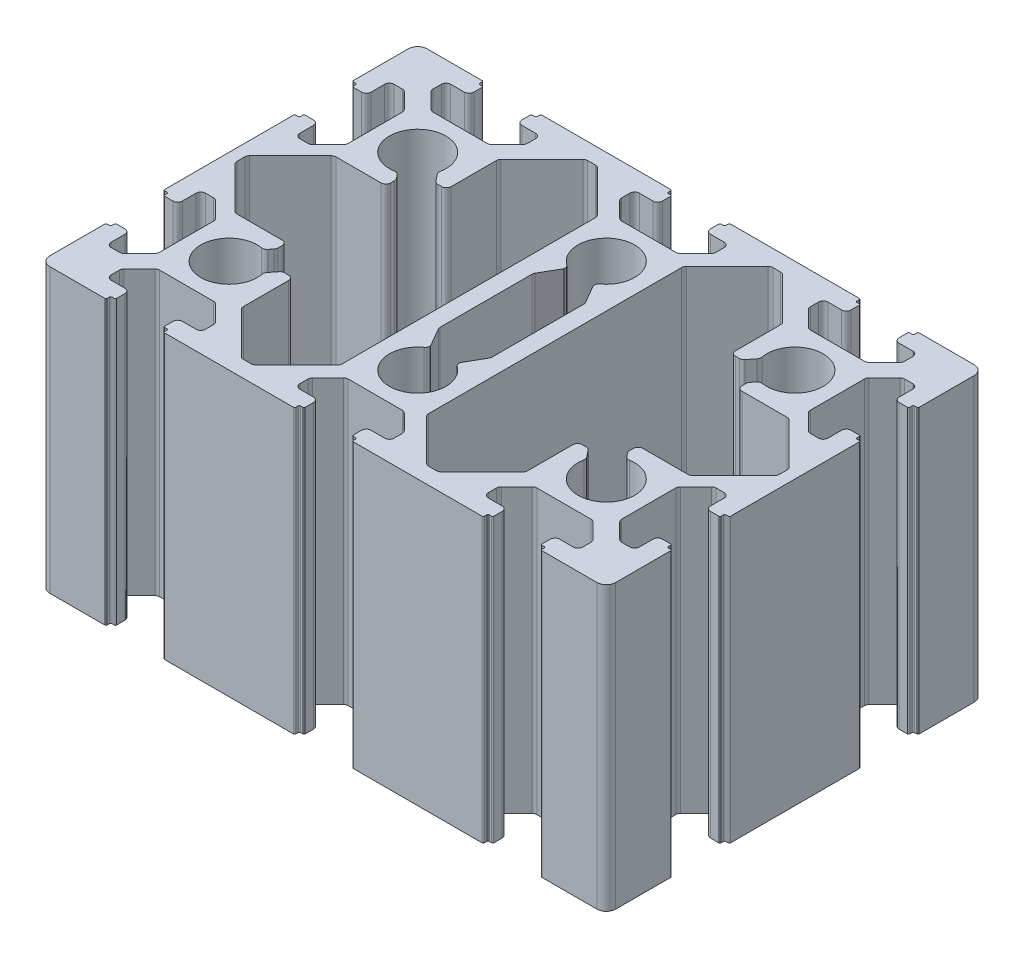
from build123d import *

# Parameters (mm, degrees)
BOSS_EXTRUDE1_DEPTH = 60


with BuildPart() as part:
    # Sketch5 → Boss-Extrude1 (new body)
    with BuildSketch(Plane(origin=(0, 0, 0), x_dir=(1, 0, 0), z_dir=(0, 1, 0))):
        with BuildLine():
            Line((5.735786438, 29), (-5.735786438, 29))
            ThreePointArc((-5.735786438, 29), (-6.11846987, 29.076120467), (-6.442893219, 29.292893219))
            Line((-6.442893219, 29.292893219), (-9.707106781, 32.557106781))
            ThreePointArc((-9.707106781, 32.557106781), (-9.923879533, 32.88153013), (-10, 33.264213562))
            Line((-10, 33.264213562), (-10, 35))
            ThreePointArc((-10, 35), (-9.707106781, 35.707106781), (-9, 36))
            Line((-9, 36), (-6.1, 36))
            ThreePointArc((-6.1, 36), (-5.392893219, 36.292893219), (-5.1, 37))
            Line((-5.1, 37), (-5.1, 38.75))
            ThreePointArc((-5.1, 38.75), (-5.173223305, 38.926776695), (-5.35, 39))
            Line((-5.35, 39), (-5.85, 39))
            ThreePointArc((-5.85, 39), (-6.026776695, 39.073223305), (-6.1, 39.25))
            Line((-6.1, 39.25), (-6.1, 39.75))
            ThreePointArc((-6.1, 39.75), (-6.173223305, 39.926776695), (-6.35, 40))
            Line((-6.35, 40), (-33.65, 40))
            ThreePointArc((-33.65, 40), (-33.826776695, 39.926776695), (-33.9, 39.75))
            Line((-33.9, 39.75), (-33.9, 39.25))
            ThreePointArc((-33.9, 39.25), (-33.973223305, 39.073223305), (-34.15, 39))
            Line((-34.15, 39), (-34.65, 39))
            ThreePointArc((-34.65, 39), (-34.826776695, 38.926776695), (-34.9, 38.75))
            Line((-34.9, 38.75), (-34.9, 37))
            ThreePointArc((-34.9, 37), (-34.607106781, 36.292893219), (-33.9, 36))
            Line((-33.9, 36), (-31, 36))
            ThreePointArc((-31, 36), (-30.292893219, 35.707106781), (-30, 35))
            Line((-30, 35), (-30, 33.264213562))
            ThreePointArc((-30, 33.264213562), (-30.076120467, 32.88153013), (-30.292893219, 32.557106781))
            Line((-30.292893219, 32.557106781), (-33.557106781, 29.292893219))
            ThreePointArc((-33.557106781, 29.292893219), (-33.88153013, 29.076120467), (-34.264213562, 29))
            Line((-34.264213562, 29), (-45.735786438, 29))
            ThreePointArc((-45.735786438, 29), (-46.11846987, 29.076120467), (-46.442893219, 29.292893219))
            Line((-46.442893219, 29.292893219), (-49.707106781, 32.557106781))
            ThreePointArc((-49.707106781, 32.557106781), (-49.923879533, 32.88153013), (-50, 33.264213562))
            Line((-50, 33.264213562), (-50, 35))
            ThreePointArc((-50, 35), (-49.707106781, 35.707106781), (-49, 36))
            Line((-49, 36), (-46.1, 36))
            ThreePointArc((-46.1, 36), (-45.392893219, 36.292893219), (-45.1, 37))
            Line((-45.1, 37), (-45.1, 38.75))
            ThreePointArc((-45.1, 38.75), (-45.173223305, 38.926776695), (-45.35, 39))
            Line((-45.35, 39), (-45.85, 39))
            ThreePointArc((-45.85, 39), (-46.026776695, 39.073223305), (-46.1, 39.25))
            Line((-46.1, 39.25), (-46.1, 39.75))
            ThreePointArc((-46.1, 39.75), (-46.173223305, 39.926776695), (-46.35, 40))
            Line((-46.35, 40), (-58, 40))
            ThreePointArc((-58, 40), (-59.414213562, 39.414213562), (-60, 38))
            Line((-60, 38), (-60, 26.35))
            ThreePointArc((-60, 26.35), (-59.926776695, 26.173223305), (-59.75, 26.1))
            Line((-59.75, 26.1), (-59.25, 26.1))
            ThreePointArc((-59.25, 26.1), (-59.073223305, 26.026776695), (-59, 25.85))
            Line((-59, 25.85), (-59, 25.35))
            ThreePointArc((-59, 25.35), (-58.926776695, 25.173223305), (-58.75, 25.1))
            Line((-58.75, 25.1), (-57, 25.1))
            ThreePointArc((-57, 25.1), (-56.292893219, 25.392893219), (-56, 26.1))
            Line((-56, 26.1), (-56, 29))
            ThreePointArc((-56, 29), (-55.707106781, 29.707106781), (-55, 30))
            Line((-55, 30), (-53.264213562, 30))
            ThreePointArc((-53.264213562, 30), (-52.88153013, 29.923879533), (-52.557106781, 29.707106781))
            Line((-52.557106781, 29.707106781), (-49.292893219, 26.442893219))
            ThreePointArc((-49.292893219, 26.442893219), (-49.076120467, 26.11846987), (-49, 25.735786438))
            Line((-49, 25.735786438), (-49, 14.264213562))
            ThreePointArc((-49, 14.264213562), (-49.076120467, 13.88153013), (-49.292893219, 13.557106781))
            Line((-49.292893219, 13.557106781), (-52.557106781, 10.292893219))
            ThreePointArc((-52.557106781, 10.292893219), (-52.88153013, 10.076120467), (-53.264213562, 10))
            Line((-53.264213562, 10), (-55, 10))
            ThreePointArc((-55, 10), (-55.707106781, 10.292893219), (-56, 11))
            Line((-56, 11), (-56, 13.9))
            ThreePointArc((-56, 13.9), (-56.292893219, 14.607106781), (-57, 14.9))
            Line((-57, 14.9), (-58.75, 14.9))
            ThreePointArc((-58.75, 14.9), (-58.926776695, 14.826776695), (-59, 14.65))
            Line((-59, 14.65), (-59, 14.15))
            ThreePointArc((-59, 14.15), (-59.073223305, 13.973223305), (-59.25, 13.9))
            Line((-59.25, 13.9), (-59.75, 13.9))
            ThreePointArc((-59.75, 13.9), (-59.926776695, 13.826776695), (-60, 13.65))
            Line((-60, 13.65), (-60, -13.65))
            ThreePointArc((-60, -13.65), (-59.926776695, -13.826776695), (-59.75, -13.9))
            Line((-59.75, -13.9), (-59.25, -13.9))
            ThreePointArc((-59.25, -13.9), (-59.073223305, -13.973223305), (-59, -14.15))
            Line((-59, -14.15), (-59, -14.65))
            ThreePointArc((-59, -14.65), (-58.926776695, -14.826776695), (-58.75, -14.9))
            Line((-58.75, -14.9), (-57, -14.9))
            ThreePointArc((-57, -14.9), (-56.292893219, -14.607106781), (-56, -13.9))
            Line((-56, -13.9), (-56, -11))
            ThreePointArc((-56, -11), (-55.707106781, -10.292893219), (-55, -10))
            Line((-55, -10), (-53.264213562, -10))
            ThreePointArc((-53.264213562, -10), (-52.88153013, -10.076120467), (-52.557106781, -10.292893219))
            Line((-52.557106781, -10.292893219), (-49.292893219, -13.557106781))
            ThreePointArc((-49.292893219, -13.557106781), (-49.076120467, -13.88153013), (-49, -14.264213562))
            Line((-49, -14.264213562), (-49, -25.735786438))
            ThreePointArc((-49, -25.735786438), (-49.076120467, -26.11846987), (-49.292893219, -26.442893219))
            Line((-49.292893219, -26.442893219), (-52.557106781, -29.707106781))
            ThreePointArc((-52.557106781, -29.707106781), (-52.88153013, -29.923879533), (-53.264213562, -30))
            Line((-53.264213562, -30), (-55, -30))
            ThreePointArc((-55, -30), (-55.707106781, -29.707106781), (-56, -29))
            Line((-56, -29), (-56, -26.1))
            ThreePointArc((-56, -26.1), (-56.292893219, -25.392893219), (-57, -25.1))
            Line((-57, -25.1), (-58.75, -25.1))
            ThreePointArc((-58.75, -25.1), (-58.926776695, -25.173223305), (-59, -25.35))
            Line((-59, -25.35), (-59, -25.85))
            ThreePointArc((-59, -25.85), (-59.073223305, -26.026776695), (-59.25, -26.1))
            Line((-59.25, -26.1), (-59.75, -26.1))
            ThreePointArc((-59.75, -26.1), (-59.926776695, -26.173223305), (-60, -26.35))
            Line((-60, -26.35), (-60, -38))
            ThreePointArc((-60, -38), (-59.414213562, -39.414213562), (-58, -40))
            Line((-58, -40), (-46.35, -40))
            ThreePointArc((-46.35, -40), (-46.173223305, -39.926776695), (-46.1, -39.75))
            Line((-46.1, -39.75), (-46.1, -39.25))
            ThreePointArc((-46.1, -39.25), (-46.026776695, -39.073223305), (-45.85, -39))
            Line((-45.85, -39), (-45.35, -39))
            ThreePointArc((-45.35, -39), (-45.173223305, -38.926776695), (-45.1, -38.75))
            Line((-45.1, -38.75), (-45.1, -37))
            ThreePointArc((-45.1, -37), (-45.392893219, -36.292893219), (-46.1, -36))
            Line((-46.1, -36), (-49, -36))
            ThreePointArc((-49, -36), (-49.707106781, -35.707106781), (-50, -35))
            Line((-50, -35), (-50, -33.264213562))
            ThreePointArc((-50, -33.264213562), (-49.923879533, -32.88153013), (-49.707106781, -32.557106781))
            Line((-49.707106781, -32.557106781), (-46.442893219, -29.292893219))
            ThreePointArc((-46.442893219, -29.292893219), (-46.11846987, -29.076120467), (-45.735786438, -29))
            Line((-45.735786438, -29), (-34.264213562, -29))
            ThreePointArc((-34.264213562, -29), (-33.88153013, -29.076120467), (-33.557106781, -29.292893219))
            Line((-33.557106781, -29.292893219), (-30.292893219, -32.557106781))
            ThreePointArc((-30.292893219, -32.557106781), (-30.076120467, -32.88153013), (-30, -33.264213562))
            Line((-30, -33.264213562), (-30, -35))
            ThreePointArc((-30, -35), (-30.292893219, -35.707106781), (-31, -36))
            Line((-31, -36), (-33.9, -36))
            ThreePointArc((-33.9, -36), (-34.607106781, -36.292893219), (-34.9, -37))
            Line((-34.9, -37), (-34.9, -38.75))
            ThreePointArc((-34.9, -38.75), (-34.826776695, -38.926776695), (-34.65, -39))
            Line((-34.65, -39), (-34.15, -39))
            ThreePointArc((-34.15, -39), (-33.973223305, -39.073223305), (-33.9, -39.25))
            Line((-33.9, -39.25), (-33.9, -39.75))
            ThreePointArc((-33.9, -39.75), (-33.826776695, -39.926776695), (-33.65, -40))
            Line((-33.65, -40), (-6.35, -40))
            ThreePointArc((-6.35, -40), (-6.173223305, -39.926776695), (-6.1, -39.75))
            Line((-6.1, -39.75), (-6.1, -39.25))
            ThreePointArc((-6.1, -39.25), (-6.026776695, -39.073223305), (-5.85, -39))
            Line((-5.85, -39), (-5.35, -39))
            ThreePointArc((-5.35, -39), (-5.173223305, -38.926776695), (-5.1, -38.75))
            Line((-5.1, -38.75), (-5.1, -37))
            ThreePointArc((-5.1, -37), (-5.392893219, -36.292893219), (-6.1, -36))
            Line((-6.1, -36), (-9, -36))
            ThreePointArc((-9, -36), (-9.707106781, -35.707106781), (-10, -35))
            Line((-10, -35), (-10, -33.264213562))
            ThreePointArc((-10, -33.264213562), (-9.923879533, -32.88153013), (-9.707106781, -32.557106781))
            Line((-9.707106781, -32.557106781), (-6.442893219, -29.292893219))
            ThreePointArc((-6.442893219, -29.292893219), (-6.11846987, -29.076120467), (-5.735786438, -29))
            Line((-5.735786438, -29), (5.735786438, -29))
            ThreePointArc((5.735786438, -29), (6.11846987, -29.076120467), (6.442893219, -29.292893219))
            Line((6.442893219, -29.292893219), (9.707106781, -32.557106781))
            ThreePointArc((9.707106781, -32.557106781), (9.923879533, -32.88153013), (10, -33.264213562))
            Line((10, -33.264213562), (10, -35))
            ThreePointArc((10, -35), (9.707106781, -35.707106781), (9, -36))
            Line((9, -36), (6.1, -36))
            ThreePointArc((6.1, -36), (5.392893219, -36.292893219), (5.1, -37))
            Line((5.1, -37), (5.1, -38.75))
            ThreePointArc((5.1, -38.75), (5.173223305, -38.926776695), (5.35, -39))
            Line((5.35, -39), (5.85, -39))
            ThreePointArc((5.85, -39), (6.026776695, -39.073223305), (6.1, -39.25))
            Line((6.1, -39.25), (6.1, -39.75))
            ThreePointArc((6.1, -39.75), (6.173223305, -39.926776695), (6.35, -40))
            Line((6.35, -40), (33.65, -40))
            ThreePointArc((33.65, -40), (33.826776695, -39.926776695), (33.9, -39.75))
            Line((33.9, -39.75), (33.9, -39.25))
            ThreePointArc((33.9, -39.25), (33.973223305, -39.073223305), (34.15, -39))
            Line((34.15, -39), (34.65, -39))
            ThreePointArc((34.65, -39), (34.826776695, -38.926776695), (34.9, -38.75))
            Line((34.9, -38.75), (34.9, -37))
            ThreePointArc((34.9, -37), (34.607106781, -36.292893219), (33.9, -36))
            Line((33.9, -36), (31, -36))
            ThreePointArc((31, -36), (30.292893219, -35.707106781), (30, -35))
            Line((30, -35), (30, -33.264213562))
            ThreePointArc((30, -33.264213562), (30.076120467, -32.88153013), (30.292893219, -32.557106781))
            Line((30.292893219, -32.557106781), (33.557106781, -29.292893219))
            ThreePointArc((33.557106781, -29.292893219), (33.88153013, -29.076120467), (34.264213562, -29))
            Line((34.264213562, -29), (45.735786438, -29))
            ThreePointArc((45.735786438, -29), (46.11846987, -29.076120467), (46.442893219, -29.292893219))
            Line((46.442893219, -29.292893219), (49.707106781, -32.557106781))
            ThreePointArc((49.707106781, -32.557106781), (49.923879533, -32.88153013), (50, -33.264213562))
            Line((50, -33.264213562), (50, -35))
            ThreePointArc((50, -35), (49.707106781, -35.707106781), (49, -36))
            Line((49, -36), (46.1, -36))
            ThreePointArc((46.1, -36), (45.392893219, -36.292893219), (45.1, -37))
            Line((45.1, -37), (45.1, -38.75))
            ThreePointArc((45.1, -38.75), (45.173223305, -38.926776695), (45.35, -39))
            Line((45.35, -39), (45.85, -39))
            ThreePointArc((45.85, -39), (46.026776695, -39.073223305), (46.1, -39.25))
            Line((46.1, -39.25), (46.1, -39.75))
            ThreePointArc((46.1, -39.75), (46.173223305, -39.926776695), (46.35, -40))
            Line((46.35, -40), (58, -40))
            ThreePointArc((58, -40), (59.414213562, -39.414213562), (60, -38))
            Line((60, -38), (60, -26.35))
            ThreePointArc((60, -26.35), (59.926776695, -26.173223305), (59.75, -26.1))
            Line((59.75, -26.1), (59.25, -26.1))
            ThreePointArc((59.25, -26.1), (59.073223305, -26.026776695), (59, -25.85))
            Line((59, -25.85), (59, -25.35))
            ThreePointArc((59, -25.35), (58.926776695, -25.173223305), (58.75, -25.1))
            Line((58.75, -25.1), (57, -25.1))
            ThreePointArc((57, -25.1), (56.292893219, -25.392893219), (56, -26.1))
            Line((56, -26.1), (56, -29))
            ThreePointArc((56, -29), (55.707106781, -29.707106781), (55, -30))
            Line((55, -30), (53.264213562, -30))
            ThreePointArc((53.264213562, -30), (52.88153013, -29.923879533), (52.557106781, -29.707106781))
            Line((52.557106781, -29.707106781), (49.292893219, -26.442893219))
            ThreePointArc((49.292893219, -26.442893219), (49.076120467, -26.11846987), (49, -25.735786438))
            Line((49, -25.735786438), (49, -14.264213562))
            ThreePointArc((49, -14.264213562), (49.076120467, -13.88153013), (49.292893219, -13.557106781))
            Line((49.292893219, -13.557106781), (52.557106781, -10.292893219))
            ThreePointArc((52.557106781, -10.292893219), (52.88153013, -10.076120467), (53.264213562, -10))
            Line((53.264213562, -10), (55, -10))
            ThreePointArc((55, -10), (55.707106781, -10.292893219), (56, -11))
            Line((56, -11), (56, -13.9))
            ThreePointArc((56, -13.9), (56.292893219, -14.607106781), (57, -14.9))
            Line((57, -14.9), (58.75, -14.9))
            ThreePointArc((58.75, -14.9), (58.926776695, -14.826776695), (59, -14.65))
            Line((59, -14.65), (59, -14.15))
            ThreePointArc((59, -14.15), (59.073223305, -13.973223305), (59.25, -13.9))
            Line((59.25, -13.9), (59.75, -13.9))
            ThreePointArc((59.75, -13.9), (59.926776695, -13.826776695), (60, -13.65))
            Line((60, -13.65), (60, 13.65))
            ThreePointArc((60, 13.65), (59.926776695, 13.826776695), (59.75, 13.9))
            Line((59.75, 13.9), (59.25, 13.9))
            ThreePointArc((59.25, 13.9), (59.073223305, 13.973223305), (59, 14.15))
            Line((59, 14.15), (59, 14.65))
            ThreePointArc((59, 14.65), (58.926776695, 14.826776695), (58.75, 14.9))
            Line((58.75, 14.9), (57, 14.9))
            ThreePointArc((57, 14.9), (56.292893219, 14.607106781), (56, 13.9))
            Line((56, 13.9), (56, 11))
            ThreePointArc((56, 11), (55.707106781, 10.292893219), (55, 10))
            Line((55, 10), (53.264213562, 10))
            ThreePointArc((53.264213562, 10), (52.88153013, 10.076120467), (52.557106781, 10.292893219))
            Line((52.557106781, 10.292893219), (49.292893219, 13.557106781))
            ThreePointArc((49.292893219, 13.557106781), (49.076120467, 13.88153013), (49, 14.264213562))
            Line((49, 14.264213562), (49, 25.735786438))
            ThreePointArc((49, 25.735786438), (49.076120467, 26.11846987), (49.292893219, 26.442893219))
            Line((49.292893219, 26.442893219), (52.557106781, 29.707106781))
            ThreePointArc((52.557106781, 29.707106781), (52.88153013, 29.923879533), (53.264213562, 30))
            Line((53.264213562, 30), (55, 30))
            ThreePointArc((55, 30), (55.707106781, 29.707106781), (56, 29))
            Line((56, 29), (56, 26.1))
            ThreePointArc((56, 26.1), (56.292893219, 25.392893219), (57, 25.1))
            Line((57, 25.1), (58.75, 25.1))
            ThreePointArc((58.75, 25.1), (58.926776695, 25.173223305), (59, 25.35))
            Line((59, 25.35), (59, 25.85))
            ThreePointArc((59, 25.85), (59.073223305, 26.026776695), (59.25, 26.1))
            Line((59.25, 26.1), (59.75, 26.1))
            ThreePointArc((59.75, 26.1), (59.926776695, 26.173223305), (60, 26.35))
            Line((60, 26.35), (60, 38))
            ThreePointArc((60, 38), (59.414213562, 39.414213562), (58, 40))
            Line((58, 40), (46.35, 40))
            ThreePointArc((46.35, 40), (46.173223305, 39.926776695), (46.1, 39.75))
            Line((46.1, 39.75), (46.1, 39.25))
            ThreePointArc((46.1, 39.25), (46.026776695, 39.073223305), (45.85, 39))
            Line((45.85, 39), (45.35, 39))
            ThreePointArc((45.35, 39), (45.173223305, 38.926776695), (45.1, 38.75))
            Line((45.1, 38.75), (45.1, 37))
            ThreePointArc((45.1, 37), (45.392893219, 36.292893219), (46.1, 36))
            Line((46.1, 36), (49, 36))
            ThreePointArc((49, 36), (49.707106781, 35.707106781), (50, 35))
            Line((50, 35), (50, 33.264213562))
            ThreePointArc((50, 33.264213562), (49.923879533, 32.88153013), (49.707106781, 32.557106781))
            Line((49.707106781, 32.557106781), (46.442893219, 29.292893219))
            ThreePointArc((46.442893219, 29.292893219), (46.11846987, 29.076120467), (45.735786438, 29))
            Line((45.735786438, 29), (34.264213562, 29))
            ThreePointArc((34.264213562, 29), (33.88153013, 29.076120467), (33.557106781, 29.292893219))
            Line((33.557106781, 29.292893219), (30.292893219, 32.557106781))
            ThreePointArc((30.292893219, 32.557106781), (30.076120467, 32.88153013), (30, 33.264213562))
            Line((30, 33.264213562), (30, 35))
            ThreePointArc((30, 35), (30.292893219, 35.707106781), (31, 36))
            Line((31, 36), (33.9, 36))
            ThreePointArc((33.9, 36), (34.607106781, 36.292893219), (34.9, 37))
            Line((34.9, 37), (34.9, 38.75))
            ThreePointArc((34.9, 38.75), (34.826776695, 38.926776695), (34.65, 39))
            Line((34.65, 39), (34.15, 39))
            ThreePointArc((34.15, 39), (33.973223305, 39.073223305), (33.9, 39.25))
            Line((33.9, 39.25), (33.9, 39.75))
            ThreePointArc((33.9, 39.75), (33.826776695, 39.926776695), (33.65, 40))
            Line((33.65, 40), (6.35, 40))
            ThreePointArc((6.35, 40), (6.173223305, 39.926776695), (6.1, 39.75))
            Line((6.1, 39.75), (6.1, 39.25))
            ThreePointArc((6.1, 39.25), (6.026776695, 39.073223305), (5.85, 39))
            Line((5.85, 39), (5.35, 39))
            ThreePointArc((5.35, 39), (5.173223305, 38.926776695), (5.1, 38.75))
            Line((5.1, 38.75), (5.1, 37))
            ThreePointArc((5.1, 37), (5.392893219, 36.292893219), (6.1, 36))
            Line((6.1, 36), (9, 36))
            ThreePointArc((9, 36), (9.707106781, 35.707106781), (10, 35))
            Line((10, 35), (10, 33.264213562))
            ThreePointArc((10, 33.264213562), (9.923879533, 32.88153013), (9.707106781, 32.557106781))
            Line((9.707106781, 32.557106781), (6.442893219, 29.292893219))
            ThreePointArc((6.442893219, 29.292893219), (6.11846987, 29.076120467), (5.735786438, 29))
        make_face()
        with BuildLine():
            Line((-57.5, -0.835786438), (-57.5, 0.835786438))
            ThreePointArc((-57.5, 0.835786438), (-57.423879533, 1.21846987), (-57.207106781, 1.542893219))
            Line((-57.207106781, 1.542893219), (-48.542893219, 10.207106781))
            ThreePointArc((-48.542893219, 10.207106781), (-48.21846987, 10.423879533), (-47.835786438, 10.5))
            Line((-47.835786438, 10.5), (-38.25, 10.5))
            ThreePointArc((-38.25, 10.5), (-37.542893219, 10.792893219), (-37.25, 11.5))
            Line((-37.25, 11.5), (-37.25, 12.338335776))
            ThreePointArc((-37.25, 12.338335776), (-37.305140086, 12.665810574), (-37.464479487, 12.957171395))
            Line((-37.464479487, 12.957171395), (-38.061111583, 13.714507811))
            ThreePointArc((-38.061111583, 13.714507811), (-38.485942095, 14.02835795), (-39.011398939, 14.082004736))
            ThreePointArc((-39.011398939, 14.082004736), (-44.194434131, 24.290305621), (-34.105853807, 18.877930191))
            ThreePointArc((-34.105853807, 18.877930191), (-34.094936169, 18.45363348), (-33.909016621, 18.072082938))
            Line((-33.909016621, 18.072082938), (-32.773856289, 16.631164381))
            ThreePointArc((-32.773856289, 16.631164381), (-32.424892977, 16.350323497), (-31.988335776, 16.25))
            Line((-31.988335776, 16.25), (-31.15, 16.25))
            ThreePointArc((-31.15, 16.25), (-30.442893219, 16.542893219), (-30.15, 17.25))
            Line((-30.15, 17.25), (-30.15, 26.835786438))
            ThreePointArc((-30.15, 26.835786438), (-30.073879533, 27.21846987), (-29.857106781, 27.542893219))
            Line((-29.857106781, 27.542893219), (-21.192893219, 36.207106781))
            ThreePointArc((-21.192893219, 36.207106781), (-20.86846987, 36.423879533), (-20.485786438, 36.5))
            Line((-20.485786438, 36.5), (-18.814213562, 36.5))
            ThreePointArc((-18.814213562, 36.5), (-18.43153013, 36.423879533), (-18.107106781, 36.207106781))
            Line((-18.107106781, 36.207106781), (-9.442893219, 27.542893219))
            ThreePointArc((-9.442893219, 27.542893219), (-9.226120467, 27.21846987), (-9.15, 26.835786438))
            Line((-9.15, 26.835786438), (-9.15, -26.835786438))
            ThreePointArc((-9.15, -26.835786438), (-9.226120467, -27.21846987), (-9.442893219, -27.542893219))
            Line((-9.442893219, -27.542893219), (-18.107106781, -36.207106781))
            ThreePointArc((-18.107106781, -36.207106781), (-18.43153013, -36.423879533), (-18.814213562, -36.5))
            Line((-18.814213562, -36.5), (-20.485786438, -36.5))
            ThreePointArc((-20.485786438, -36.5), (-20.86846987, -36.423879533), (-21.192893219, -36.207106781))
            Line((-21.192893219, -36.207106781), (-29.857106781, -27.542893219))
            ThreePointArc((-29.857106781, -27.542893219), (-30.073879533, -27.21846987), (-30.15, -26.835786438))
            Line((-30.15, -26.835786438), (-30.15, -17.25))
            ThreePointArc((-30.15, -17.25), (-30.442893219, -16.542893219), (-31.15, -16.25))
            Line((-31.15, -16.25), (-31.988335776, -16.25))
            ThreePointArc((-31.988335776, -16.25), (-32.424892977, -16.350323497), (-32.773856289, -16.631164381))
            Line((-32.773856289, -16.631164381), (-33.909016621, -18.072082938))
            ThreePointArc((-33.909016621, -18.072082938), (-34.094936169, -18.45363348), (-34.105853807, -18.877930191))
            ThreePointArc((-34.105853807, -18.877930191), (-44.194434131, -24.290305621), (-39.011398939, -14.082004736))
            ThreePointArc((-39.011398939, -14.082004736), (-38.485942095, -14.02835795), (-38.061111583, -13.714507811))
            Line((-38.061111583, -13.714507811), (-37.464479487, -12.957171395))
            ThreePointArc((-37.464479487, -12.957171395), (-37.305140086, -12.665810574), (-37.25, -12.338335776))
            Line((-37.25, -12.338335776), (-37.25, -11.5))
            ThreePointArc((-37.25, -11.5), (-37.542893219, -10.792893219), (-38.25, -10.5))
            Line((-38.25, -10.5), (-47.835786438, -10.5))
            ThreePointArc((-47.835786438, -10.5), (-48.21846987, -10.423879533), (-48.542893219, -10.207106781))
            Line((-48.542893219, -10.207106781), (-57.207106781, -1.542893219))
            ThreePointArc((-57.207106781, -1.542893219), (-57.423879533, -1.21846987), (-57.5, -0.835786438))
        make_face(mode=Mode.SUBTRACT)
        with BuildLine():
            Line((-5.5, -9.732050808), (-5.5, 9.732050808))
            ThreePointArc((-5.5, 9.732050808), (-5.465925826, 9.990869853), (-5.366025404, 10.232050808))
            Line((-5.366025404, 10.232050808), (-3.118837295, 14.124294787))
            Line((-3.118837295, 14.124294787), (-3.118837295, 14.340037161))
            ThreePointArc((-3.118837295, 14.340037161), (-3.227656806, 14.793686074), (-3.530431967, 15.148603281))
            ThreePointArc((-3.530431967, 15.148603281), (0, 26), (3.530431967, 15.148603281))
            ThreePointArc((3.530431967, 15.148603281), (3.227656806, 14.793686074), (3.118837295, 14.340037161))
            Line((3.118837295, 14.340037161), (3.118837295, 14.124294787))
            Line((3.118837295, 14.124294787), (5.366025404, 10.232050808))
            ThreePointArc((5.366025404, 10.232050808), (5.465925826, 9.990869853), (5.5, 9.732050808))
            Line((5.5, 9.732050808), (5.5, -9.732050808))
            ThreePointArc((5.5, -9.732050808), (5.465925826, -9.990869853), (5.366025404, -10.232050808))
            Line((5.366025404, -10.232050808), (3.118837295, -14.124294787))
            Line((3.118837295, -14.124294787), (3.118837295, -14.340037161))
            ThreePointArc((3.118837295, -14.340037161), (3.227656806, -14.793686074), (3.530431967, -15.148603281))
            ThreePointArc((3.530431967, -15.148603281), (0, -26), (-3.530431967, -15.148603281))
            ThreePointArc((-3.530431967, -15.148603281), (-3.227656806, -14.793686074), (-3.118837295, -14.340037161))
            Line((-3.118837295, -14.340037161), (-3.118837295, -14.124294787))
            Line((-3.118837295, -14.124294787), (-5.366025404, -10.232050808))
            ThreePointArc((-5.366025404, -10.232050808), (-5.465925826, -9.990869853), (-5.5, -9.732050808))
        make_face(mode=Mode.SUBTRACT)
        with BuildLine():
            Line((57.207106781, -1.542893219), (48.542893219, -10.207106781))
            ThreePointArc((48.542893219, -10.207106781), (48.21846987, -10.423879533), (47.835786438, -10.5))
            Line((47.835786438, -10.5), (38.25, -10.5))
            ThreePointArc((38.25, -10.5), (37.542893219, -10.792893219), (37.25, -11.5))
            Line((37.25, -11.5), (37.25, -12.338335776))
            ThreePointArc((37.25, -12.338335776), (37.305140086, -12.665810574), (37.464479487, -12.957171395))
            Line((37.464479487, -12.957171395), (38.061111583, -13.714507811))
            ThreePointArc((38.061111583, -13.714507811), (38.485942095, -14.02835795), (39.011398939, -14.082004736))
            ThreePointArc((39.011398939, -14.082004736), (44.194434131, -24.290305621), (34.105853807, -18.877930191))
            ThreePointArc((34.105853807, -18.877930191), (34.094936169, -18.45363348), (33.909016621, -18.072082938))
            Line((33.909016621, -18.072082938), (32.773856289, -16.631164381))
            ThreePointArc((32.773856289, -16.631164381), (32.424892977, -16.350323497), (31.988335776, -16.25))
            Line((31.988335776, -16.25), (31.15, -16.25))
            ThreePointArc((31.15, -16.25), (30.442893219, -16.542893219), (30.15, -17.25))
            Line((30.15, -17.25), (30.15, -26.835786438))
            ThreePointArc((30.15, -26.835786438), (30.073879533, -27.21846987), (29.857106781, -27.542893219))
            Line((29.857106781, -27.542893219), (21.192893219, -36.207106781))
            ThreePointArc((21.192893219, -36.207106781), (20.86846987, -36.423879533), (20.485786438, -36.5))
            Line((20.485786438, -36.5), (18.814213562, -36.5))
            ThreePointArc((18.814213562, -36.5), (18.43153013, -36.423879533), (18.107106781, -36.207106781))
            Line((18.107106781, -36.207106781), (9.442893219, -27.542893219))
            ThreePointArc((9.442893219, -27.542893219), (9.226120467, -27.21846987), (9.15, -26.835786438))
            Line((9.15, -26.835786438), (9.15, 26.835786438))
            ThreePointArc((9.15, 26.835786438), (9.226120467, 27.21846987), (9.442893219, 27.542893219))
            Line((9.442893219, 27.542893219), (18.107106781, 36.207106781))
            ThreePointArc((18.107106781, 36.207106781), (18.43153013, 36.423879533), (18.814213562, 36.5))
            Line((18.814213562, 36.5), (20.485786438, 36.5))
            ThreePointArc((20.485786438, 36.5), (20.86846987, 36.423879533), (21.192893219, 36.207106781))
            Line((21.192893219, 36.207106781), (29.857106781, 27.542893219))
            ThreePointArc((29.857106781, 27.542893219), (30.073879533, 27.21846987), (30.15, 26.835786438))
            Line((30.15, 26.835786438), (30.15, 17.25))
            ThreePointArc((30.15, 17.25), (30.442893219, 16.542893219), (31.15, 16.25))
            Line((31.15, 16.25), (31.988335776, 16.25))
            ThreePointArc((31.988335776, 16.25), (32.424892977, 16.350323497), (32.773856289, 16.631164381))
            Line((32.773856289, 16.631164381), (33.909016621, 18.072082938))
            ThreePointArc((33.909016621, 18.072082938), (34.094936169, 18.45363348), (34.105853807, 18.877930191))
            ThreePointArc((34.105853807, 18.877930191), (44.194434131, 24.290305621), (39.011398939, 14.082004736))
            ThreePointArc((39.011398939, 14.082004736), (38.485942095, 14.02835795), (38.061111583, 13.714507811))
            Line((38.061111583, 13.714507811), (37.464479487, 12.957171395))
            ThreePointArc((37.464479487, 12.957171395), (37.305140086, 12.665810574), (37.25, 12.338335776))
            Line((37.25, 12.338335776), (37.25, 11.5))
            ThreePointArc((37.25, 11.5), (37.542893219, 10.792893219), (38.25, 10.5))
            Line((38.25, 10.5), (47.835786438, 10.5))
            ThreePointArc((47.835786438, 10.5), (48.21846987, 10.423879533), (48.542893219, 10.207106781))
            Line((48.542893219, 10.207106781), (57.207106781, 1.542893219))
            ThreePointArc((57.207106781, 1.542893219), (57.423879533, 1.21846987), (57.5, 0.835786438))
            Line((57.5, 0.835786438), (57.5, -0.835786438))
            ThreePointArc((57.5, -0.835786438), (57.423879533, -1.21846987), (57.207106781, -1.542893219))
        make_face(mode=Mode.SUBTRACT)
    extrude(amount=BOSS_EXTRUDE1_DEPTH)


solid = part.part
